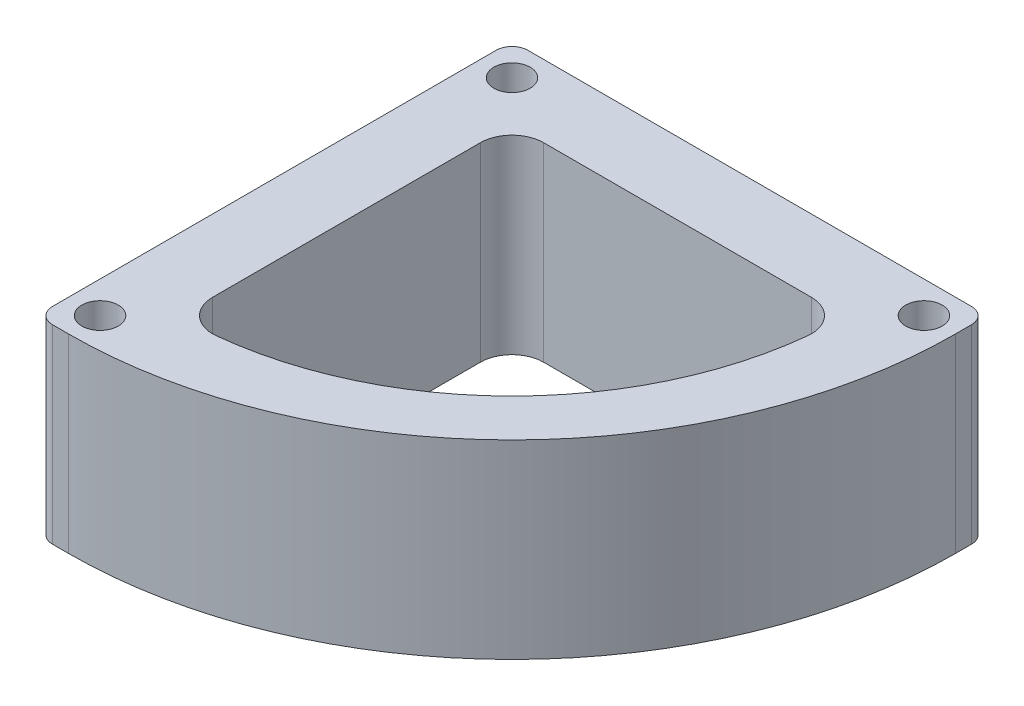
from build123d import *

# Parameters (mm, degrees)
SKETCH_1_W          = 30
SKETCH_1_H          = 30
SKETCH_1_R          = 1.15
EXTRUDE_1_DEPTH     = 12
FILLET_1_R          = 28
FILLET_2_R          = 1
CUT_EXTRUDE_3_DEPTH = 22


with BuildPart() as part:
    # 草图1 → 凸台-拉伸1 (new body)
    with BuildSketch(Plane(origin=(0, 0, 0), x_dir=(1, 0, 0), z_dir=(0, 1, 0))):
        Rectangle(SKETCH_1_W, SKETCH_1_H)
        with Locations(Location((13, 13, 0), (0, 0, 270))):
            Circle(SKETCH_1_R, mode=Mode.SUBTRACT)
        with Locations(Location((13, -13, 0), (0, 0, 90))):
            Circle(SKETCH_1_R, mode=Mode.SUBTRACT)
        with Locations(Location((-13, -13, 0), (0, 0, 270))):
            Circle(SKETCH_1_R, mode=Mode.SUBTRACT)
        with Locations(Location((-13, 13, 0), (0, 0, 90))):
            Circle(SKETCH_1_R, mode=Mode.SUBTRACT)
    extrude(amount=EXTRUDE_1_DEPTH)

    # 圆角1
    fillet_1_edges = [part.edges().sort_by_distance(p)[0] for p in [
        (15, 6, 15),
    ]]
    fillet(fillet_1_edges, radius=FILLET_1_R)

    # 圆角2
    fillet_2_edges = [part.edges().sort_by_distance(p)[0] for p in [
        (-15, 6, 15),
        (-15, 6, -15),
        (15, 6, -15),
    ]]
    fillet(fillet_2_edges, radius=FILLET_2_R)

    # 草图2 → 切除-拉伸3 (cut)
    with BuildSketch(Plane(origin=(0, 0, 0), x_dir=(1, 0, 0), z_dir=(0, 1, 0))):
        with BuildLine():
            Line((8.447221814, 10.447221814), (-8.447221814, 10.447221814))
            ThreePointArc((-8.447221814, 10.447221814), (-9.861435376, 9.861435376), (-10.447221814, 8.447221814))
            Line((-10.447221814, 8.447221814), (-10.447221814, -8.447221814))
            ThreePointArc((-10.447221814, -8.447221814), (-9.784933922, -9.934005697), (-8.236695498, -10.436110617))
            ThreePointArc((-8.236695498, -10.436110617), (4.402020591, -4.402020591), (10.436110617, 8.236695498))
            ThreePointArc((10.436110617, 8.236695498), (9.934005697, 9.784933922), (8.447221814, 10.447221814))
        make_face()
    extrude(amount=CUT_EXTRUDE_3_DEPTH, mode=Mode.SUBTRACT)


solid = part.part
